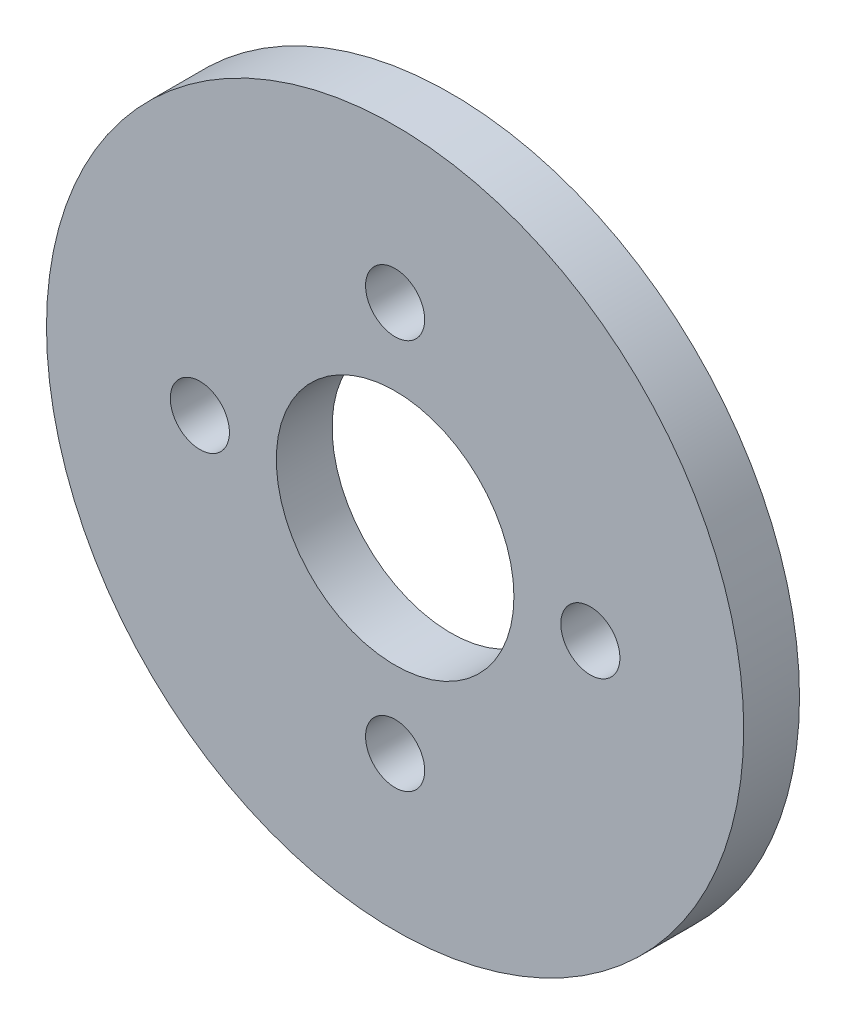
from build123d import *

# Parameters (mm, degrees)
SZKIC1_R                    = 62.5
SZKIC1_R_2                  = 5.3
SZKIC1_R_3                  = 21.3
DODANIE_WYCI_GNI_CIE3_DEPTH = 10


with BuildPart() as part:
    # Szkic1 → Dodanie-wyciągnięcie3 (new body)
    with BuildSketch(Plane.XY):
        Circle(SZKIC1_R)
        with Locations((0, 35)):
            Circle(SZKIC1_R_2, mode=Mode.SUBTRACT)
        with Locations((35, 0)):
            Circle(SZKIC1_R_2, mode=Mode.SUBTRACT)
        with Locations((0, -35)):
            Circle(SZKIC1_R_2, mode=Mode.SUBTRACT)
        with Locations((-35, 0)):
            Circle(SZKIC1_R_2, mode=Mode.SUBTRACT)
        Circle(SZKIC1_R_3, mode=Mode.SUBTRACT)
    extrude(amount=DODANIE_WYCI_GNI_CIE3_DEPTH)


solid = part.part
